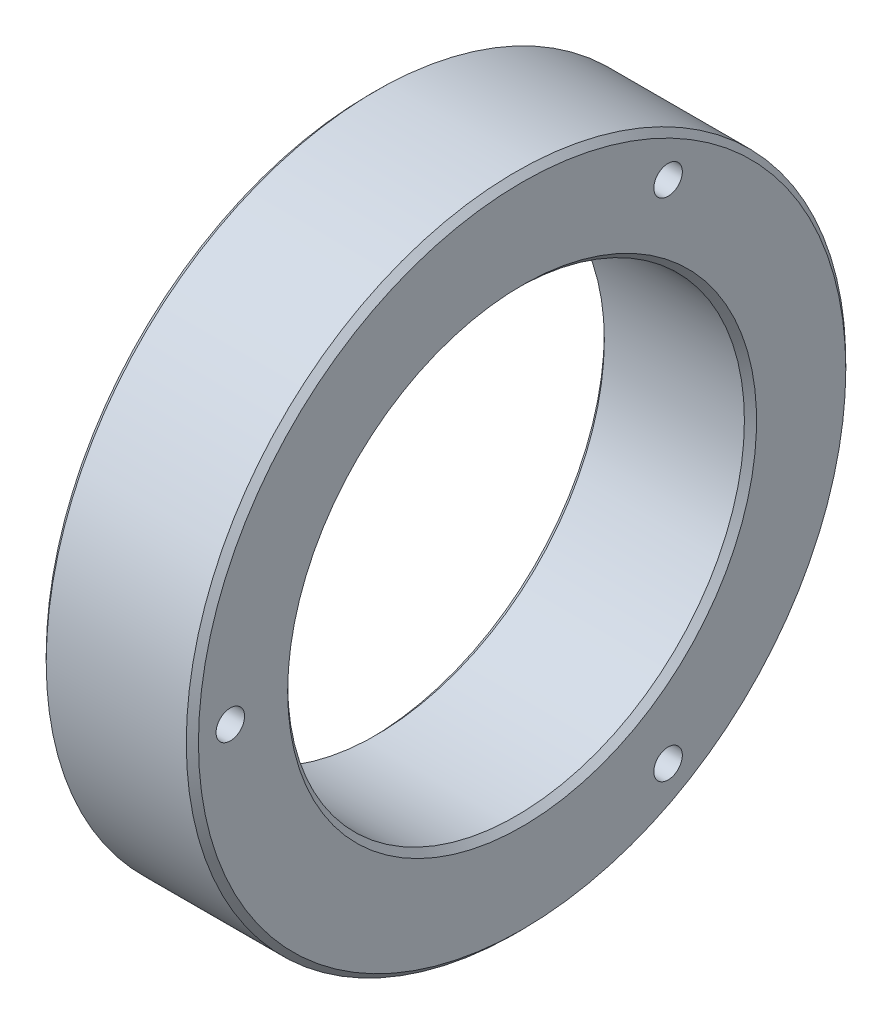
from build123d import *

# Parameters (mm, degrees)
SKETCH1_W           = 25.3746
SKETCH1_H           = 38.1
CHAMFER1_SIZE       = 1.524
SKETCH2_R           = 3.5687
CUT_EXTRUDE2_DEPTH  = 38.1
SKETCH3_R           = 5.5626
CUT_EXTRUDE4_DEPTH  = 7.112
SKETCH4_R           = 3.5687
CUT_EXTRUDE6_DEPTH  = 38.1
SKETCH5_R           = 5.5626
CUT_EXTRUDE8_DEPTH  = 7.112
SKETCH6_R           = 3.5687
CUT_EXTRUDE10_DEPTH = 38.1
SKETCH7_R           = 5.5626
CUT_EXTRUDE12_DEPTH = 7.112
SKETCH8_R           = 3.96875
CUT_EXTRUDE14_DEPTH = 25.4
SKETCH9_R           = 3.96875
CUT_EXTRUDE16_DEPTH = 25.4


with BuildPart() as part:
    # Sketch1 → Revolve1 (revolve)
    with BuildSketch(Plane(origin=(0, 0, 0), x_dir=(0, 1, 0), z_dir=(0, 0, 1))):
        with Locations((69.8373, -19.05)):
            Rectangle(SKETCH1_W, SKETCH1_H)
    revolve(axis=Axis((-25.4, 0, 0), (1, 0, 0)))

    # Chamfer1
    chamfer1_edges = [part.edges().sort_by_distance(p)[0] for p in [
        (38.1, -57.15, 0),
        (0, -57.15, 0),
        (38.1, -82.5246, 0),
        (0, -82.5246, 0),
    ]]
    chamfer(chamfer1_edges, length=CHAMFER1_SIZE)

    # Sketch2 → Cut-Extrude2 (cut)
    with BuildSketch(Plane.YZ):
        with Locations((0, 73.025)):
            Circle(SKETCH2_R)
    extrude(amount=CUT_EXTRUDE2_DEPTH, mode=Mode.SUBTRACT)

    # Sketch3 → Cut-Extrude4 (cut)
    with BuildSketch(Plane.YZ):
        with Locations((0, 73.025)):
            Circle(SKETCH3_R)
    extrude(amount=CUT_EXTRUDE4_DEPTH, mode=Mode.SUBTRACT)

    # Sketch4 → Cut-Extrude6 (cut)
    with BuildSketch(Plane.YZ):
        with Locations((-63.246, -36.5252)):
            Circle(SKETCH4_R)
    extrude(amount=CUT_EXTRUDE6_DEPTH, mode=Mode.SUBTRACT)

    # Sketch5 → Cut-Extrude8 (cut)
    with BuildSketch(Plane.YZ):
        with Locations((-63.246, -36.5252)):
            Circle(SKETCH5_R)
    extrude(amount=CUT_EXTRUDE8_DEPTH, mode=Mode.SUBTRACT)

    # Sketch6 → Cut-Extrude10 (cut)
    with BuildSketch(Plane.YZ):
        with Locations((63.246, -36.5252)):
            Circle(SKETCH6_R)
    extrude(amount=CUT_EXTRUDE10_DEPTH, mode=Mode.SUBTRACT)

    # Sketch7 → Cut-Extrude12 (cut)
    with BuildSketch(Plane.YZ):
        with Locations((63.246, -36.5252)):
            Circle(SKETCH7_R)
    extrude(amount=CUT_EXTRUDE12_DEPTH, mode=Mode.SUBTRACT)

    # Sketch8 → Cut-Extrude14 (cut)
    with BuildSketch(Plane.YZ):
        with Locations((-69.85, 0)):
            Circle(SKETCH8_R)
    extrude(amount=CUT_EXTRUDE14_DEPTH, mode=Mode.SUBTRACT)

    # Sketch9 → Cut-Extrude16 (cut)
    with BuildSketch(Plane.YZ):
        with Locations((69.85, 0)):
            Circle(SKETCH9_R)
    extrude(amount=CUT_EXTRUDE16_DEPTH, mode=Mode.SUBTRACT)


solid = part.part
